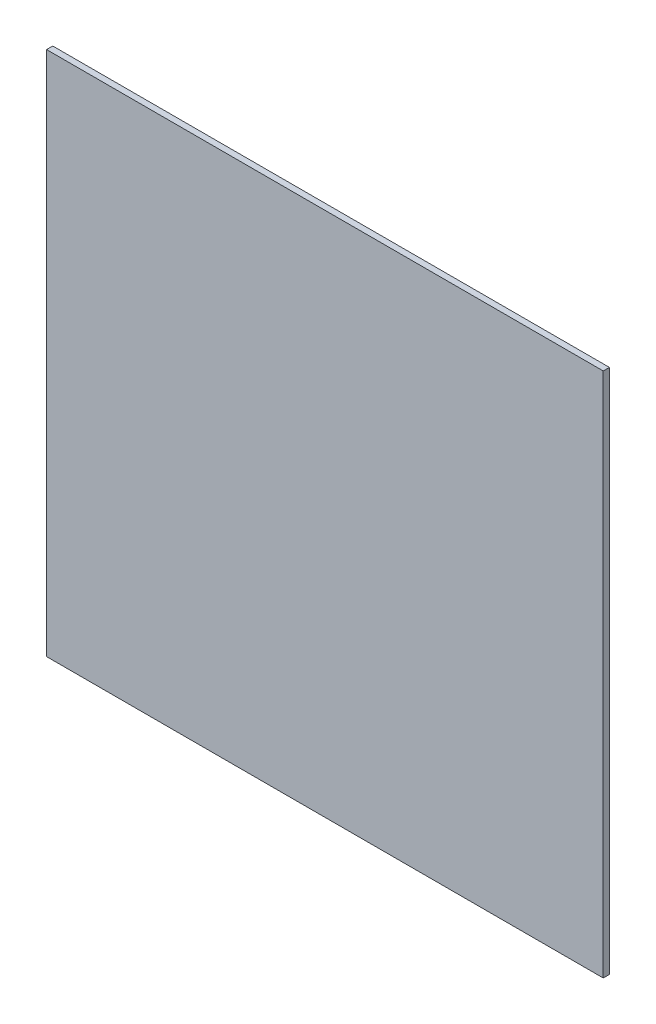
from build123d import *

# Parameters (mm, degrees)
SKETCH1_W           = 360
SKETCH1_H           = 340
BOSS_EXTRUDE1_DEPTH = 2


with BuildPart() as part:
    # Sketch1 → Boss-Extrude1 (new, symmetric)
    with BuildSketch(Plane.XY):
        Rectangle(SKETCH1_W, SKETCH1_H)
    extrude(amount=BOSS_EXTRUDE1_DEPTH, both=True)


solid = part.part
